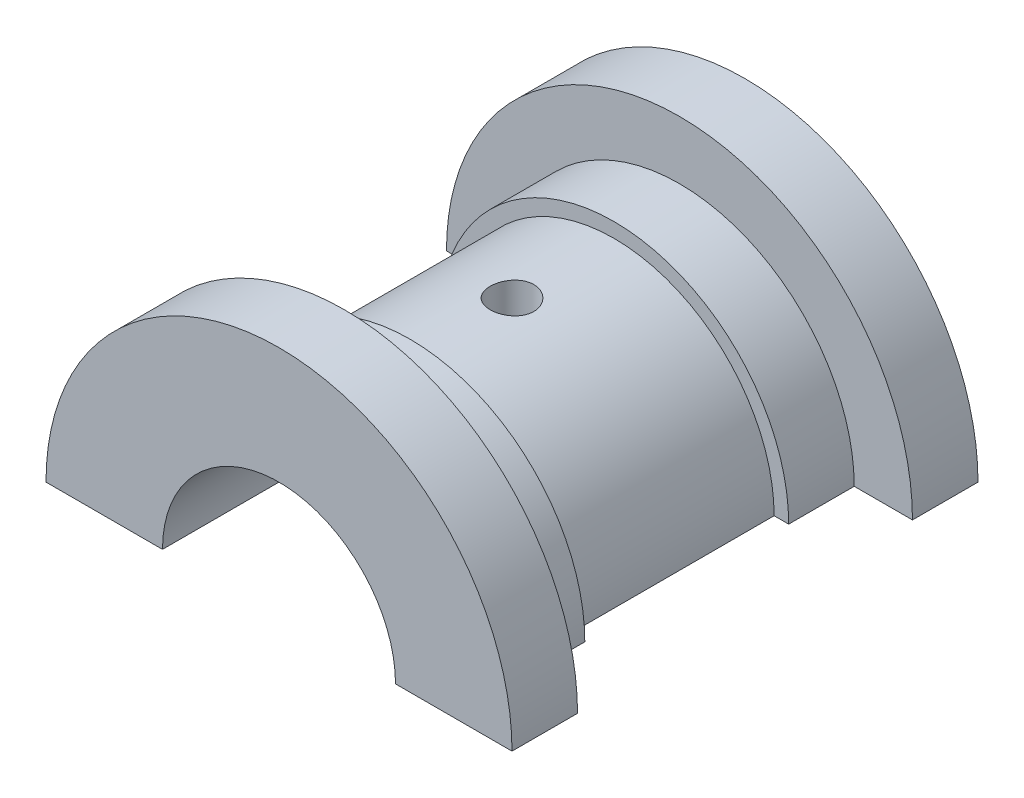
from build123d import *

# Parameters (mm, degrees)
SKETCH1_R           = 22
SKETCH1_R_2         = 16
BOSS_EXTRUDE2_DEPTH = 7
SKETCH3_R           = 24
BOSS_EXTRUDE6_DEPTH = 9
SKETCH6_R           = 32
BOSS_EXTRUDE7_DEPTH = 9
SKETCH7_R           = 16
CUT_EXTRUDE2_DEPTH  = 56.425625842
CUT_EXTRUDE3_DEPTH  = 79.383671769
SKETCH9_R           = 3
CUT_EXTRUDE4_DEPTH  = 56.036351623


with BuildPart() as part:
    # Sketch1 → Boss-Extrude2 (new, symmetric)
    with BuildSketch(Plane.XY):
        Circle(SKETCH1_R)
        Circle(SKETCH1_R_2, mode=Mode.SUBTRACT)
    extrude(amount=BOSS_EXTRUDE2_DEPTH, both=True)

    # Sketch3 → Boss-Extrude6 (add)
    with BuildSketch(Plane.XY.offset(7)):
        Circle(SKETCH3_R)
    extrude(amount=BOSS_EXTRUDE6_DEPTH)

    # Sketch6 → Boss-Extrude7 (add)
    with BuildSketch(Plane.XY.offset(16)):
        Circle(SKETCH6_R)
    extrude(amount=BOSS_EXTRUDE7_DEPTH)

    # Sketch7 → Cut-Extrude2 (cut, through all)
    with BuildSketch(Plane(origin=(0, 0, -7), x_dir=(-1, 0, 0), z_dir=(0, 0, -1))):
        Circle(SKETCH7_R)
    extrude(amount=-CUT_EXTRUDE2_DEPTH, mode=Mode.SUBTRACT)

    # Mirror3: part across plane


with BuildPart() as part_1:
    add(part.part)
    add(part.part.mirror(Plane.XY.offset(-7)))

    # Sketch8 → Cut-Extrude3 (cut, through all)
    with BuildSketch(Plane.XY.offset(25)):
        Polygon((-194.543052514, 0), (-35.372068519, 0), (34.570182834, 0), (193.741166829, 0), (193.741166829, -318.34196799), (-194.543052514, -318.34196799), align=None)
    extrude(amount=-CUT_EXTRUDE3_DEPTH, mode=Mode.SUBTRACT)

    # Sketch9 → Cut-Extrude4 (cut, through all)
    with BuildSketch(Plane(origin=(0, 22, 0), x_dir=(1, 0, 0), z_dir=(0, 1, 0))):
        with Locations(Location((0, 7, 0), (0, 0, 270))):
            Circle(SKETCH9_R)
    extrude(amount=-CUT_EXTRUDE4_DEPTH, mode=Mode.SUBTRACT)


solid = part_1.part
